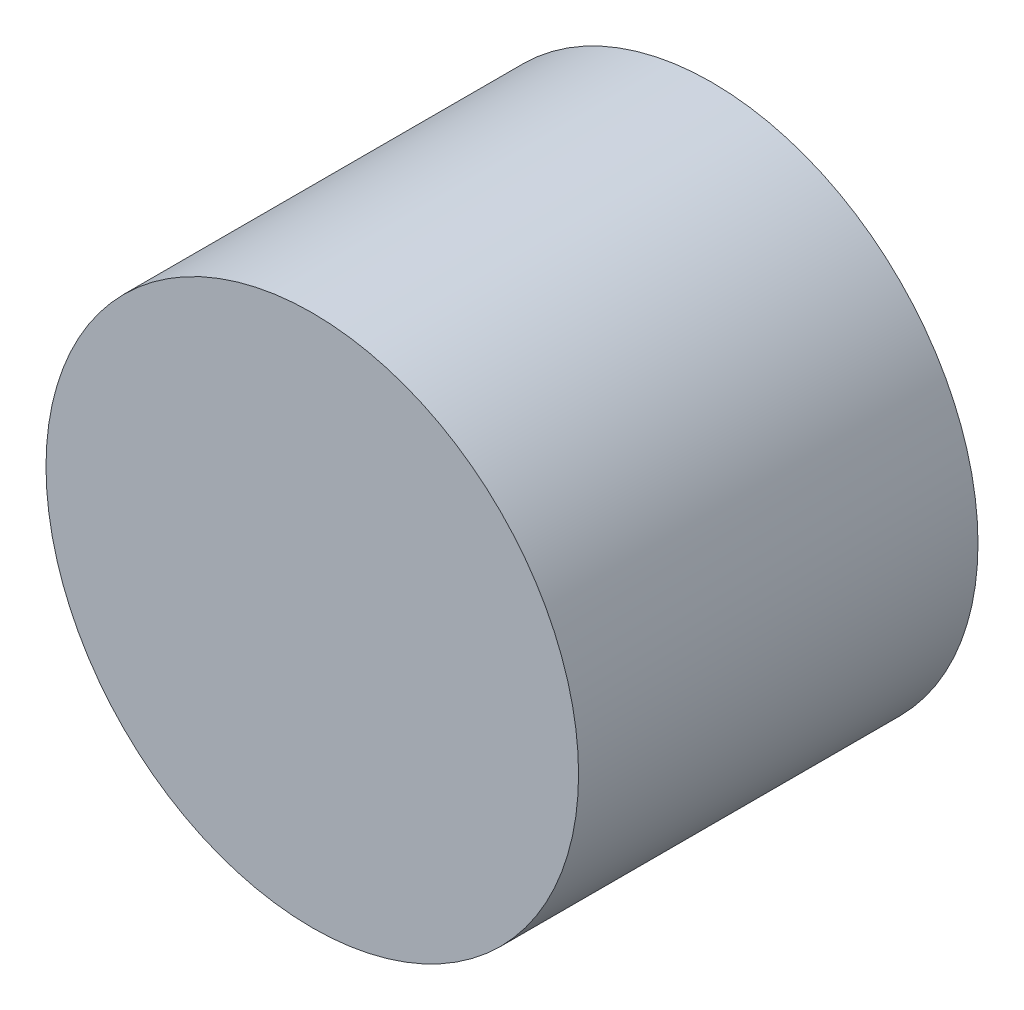
from build123d import *

# Parameters (mm, degrees)
TOOTHEXTRUDECUTGEARBELT01_DEPTH = 4.876799927
PATTERNGEARBELT01_COUNT         = 15
BOREREVOLVESKETCH_W             = 12.801599808
BOREREVOLVESKETCH_H             = 3
SKETCH_1_R                      = 10
EXTRUDE_1_DEPTH                 = 15


with BuildPart() as part:
    # SketchRevolveGearBelt01 → GearBelt01 (revolve)
    with BuildSketch(Plane(origin=(0, 0, 0), x_dir=(0, 0, -1), z_dir=(1, 0, 0))):
        Polygon((6.400799904, 0), (6.400799904, 6.145458216), (5.638799915, 6.145458216), (5.638799915, 7.009886979), (6.201536555, 8.368453407), (5.497540362, 8.660058178), (4.876799927, 7.161458201), (4.876799927, 6.780458207), (-4.876799927, 6.780458207), (-4.876799927, 7.161458201), (-5.497540362, 8.660058178), (-6.201536555, 8.368453407), (-5.638799915, 7.009886979), (-5.638799915, 6.145458216), (-6.400799904, 6.145458216), (-6.400799904, 0), align=None)
    revolve(axis=Axis((0, 0, 0), (0, 0, -1)))

    # SketchToothGearBelt01 → ToothExtrudeCutGearBelt01 (cut, symmetric)
    with BuildSketch(Plane.XY):
        with BuildLine():
            ThreePointArc((6.661096355, 1.272831888), (6.78161527, 0), (6.661096355, -1.272831888))
            add(Edge.make_bspline(
                [(6.661096355, -1.272831888), (6.663615018, -1.259659662), (6.665647801, -1.239568599), (6.664820876, -1.212733988), (6.662437583, -1.192740045), (6.658309361, -1.173032278), (6.652468102, -1.15376267), (6.644958835, -1.135079815), (6.635839471, -1.117127785), (6.625180333, -1.100045019), (6.613063619, -1.083963244), (6.599582765, -1.06900649), (6.584841733, -1.055290043), (6.568954182, -1.042919864), (6.552042687, -1.031990656), (6.534237438, -1.022589264), (6.515676569, -1.014778616), (6.49650012, -1.00865466), (6.476867505, -1.00413133), (6.427750984, -0.998255219), (6.361870769, -0.993498048), (6.280955314, -0.976758348), (6.213857662, -0.957771629), (6.148468462, -0.93346319), (6.085179943, -0.904141421), (6.024383488, -0.869943856), (5.966451939, -0.831092016), (5.9117414, -0.787821543), (5.860587957, -0.740399103), (5.813305895, -0.689115832), (5.770185727, -0.634286865), (5.731492294, -0.576249049), (5.697463629, -0.515358957), (5.668307661, -0.451990704), (5.644207759, -0.386533555), (5.625296172, -0.319389892), (5.611748114, -0.250971402), (5.603426544, -0.18170154), (5.601350103, -0.116556682), (5.601805881, -0.056000917), (5.601665396, 0), (5.601805881, 0.056000917), (5.601350103, 0.116556682), (5.603426544, 0.18170154), (5.611748114, 0.250971402), (5.625296172, 0.319389892), (5.644207759, 0.386533555), (5.668307661, 0.451990704), (5.697463629, 0.515358957), (5.731492294, 0.576249049), (5.770185727, 0.634286865), (5.813305895, 0.689115832), (5.860587957, 0.740399103), (5.9117414, 0.787821543), (5.966451939, 0.831092016), (6.024383488, 0.869943856), (6.085179943, 0.904141421), (6.148468462, 0.93346319), (6.213857662, 0.957771629), (6.280955314, 0.976758348), (6.361870769, 0.993498048), (6.427750984, 0.998255219), (6.476867505, 1.00413133), (6.49650012, 1.00865466), (6.515676569, 1.014778616), (6.534237438, 1.022589264), (6.552042687, 1.031990656), (6.568954182, 1.042919864), (6.584841733, 1.055290043), (6.599582765, 1.06900649), (6.613063619, 1.083963244), (6.625180333, 1.100045019), (6.635839471, 1.117127785), (6.644958835, 1.135079815), (6.652468102, 1.15376267), (6.658309361, 1.173032278), (6.662437583, 1.192740045), (6.664820876, 1.212733988), (6.665647801, 1.239568599), (6.663615018, 1.259659662), (6.661096355, 1.272831888)],
                knots=[0, 0, 0, 0, 0.010832325, 0.016248488, 0.021664651, 0.027080813, 0.032496976, 0.037913139, 0.043329302, 0.048745464, 0.054161627, 0.05957779, 0.064993952, 0.070410115, 0.075826278, 0.08124244, 0.086658603, 0.092074766, 0.097490929, 0.102907091, 0.132017291, 0.150784932, 0.169552572, 0.188320213, 0.207087853, 0.225855493, 0.244623134, 0.263390774, 0.282158415, 0.300926055, 0.319693695, 0.338461336, 0.357228976, 0.375996617, 0.394764257, 0.413531897, 0.432299538, 0.451067178, 0.469834819, 0.484917409, 0.5, 0.515082591, 0.530165181, 0.548932822, 0.567700462, 0.586468103, 0.605235743, 0.624003383, 0.642771024, 0.661538664, 0.680306305, 0.699073945, 0.717841585, 0.736609226, 0.755376866, 0.774144507, 0.792912147, 0.811679787, 0.830447428, 0.849215068, 0.867982709, 0.897092909, 0.902509071, 0.907925234, 0.913341397, 0.91875756, 0.924173722, 0.929589885, 0.935006048, 0.94042221, 0.945838373, 0.951254536, 0.956670698, 0.962086861, 0.967503024, 0.972919187, 0.978335349, 0.983751512, 0.989167675, 1, 1, 1, 1], degree=3))
        make_face()
    toothextrudecutgearbelt01 = extrude(amount=TOOTHEXTRUDECUTGEARBELT01_DEPTH, both=True, mode=Mode.SUBTRACT)

    # PatternGearBelt01: ToothExtrudeCutGearBelt01 ×15 about axis
    patterngearbelt01_axis = Axis((0, 0, 55), (0, 0, -1))
    for i in range(1, PATTERNGEARBELT01_COUNT):
        add(toothextrudecutgearbelt01.rotate(patterngearbelt01_axis, i * 360 / PATTERNGEARBELT01_COUNT), mode=Mode.SUBTRACT)

    # BoreRevolveSketch → BoreRevolveCut (revolve, cut)
    with BuildSketch(Plane(origin=(0, 0, 0), x_dir=(0, 0, -1), z_dir=(1, 0, 0))):
        with Locations((0, 1.5)):
            Rectangle(BOREREVOLVESKETCH_W, BOREREVOLVESKETCH_H)
    revolve(axis=Axis((0, 0, 0), (0, 0, -1)), mode=Mode.SUBTRACT)

    # 草图1 → 凸台-拉伸1 (add)
    with BuildSketch(Plane(origin=(0, 0, -6.400799904), x_dir=(-1, 0, 0), z_dir=(0, 0, -1))):
        Circle(SKETCH_1_R)
    extrude(amount=-EXTRUDE_1_DEPTH)


solid = part.part
